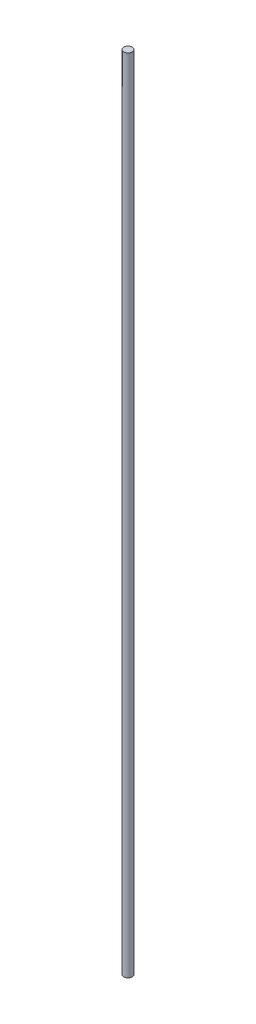
from build123d import *

# Parameters (mm, degrees)
SKETCH1_R           = 1.5875
BOSS_EXTRUDE1_DEPTH = 150


with BuildPart() as part:
    # Sketch1 → Boss-Extrude1 (new, symmetric)
    with BuildSketch(Plane(origin=(0, 0, 0), x_dir=(1, 0, 0), z_dir=(0, 1, 0))):
        with Locations(Location((0, 0, 0), (0, 0, 270))):
            Circle(SKETCH1_R)
    extrude(amount=BOSS_EXTRUDE1_DEPTH, both=True)


solid = part.part
